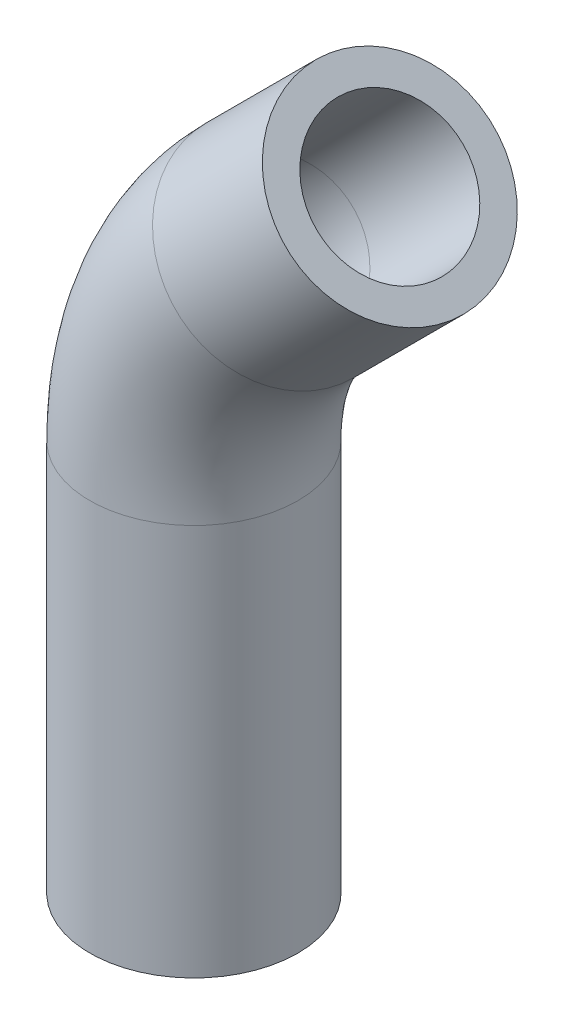
from build123d import *

# Parameters (mm, degrees)
SWEEP1_PROFILE_R     = 13.49375
CUT_SWEEP1_PROFILE_R = 9.525


with BuildPart() as part:
    # Sweep1: sweep along a curve in space
    with BuildLine() as sweep1_path:
        Line((0, 0, 0), (0, 50.8, 0))
        ThreePointArc((0, 50.8, 0), (2.900189811, 65.380238773, 0), (11.159231637, 77.740768363, 0))
        Line((11.159231637, 77.740768363, 0), (25.4, 91.981536726, 0))
    # Sweep1 profile (on start of the path) → Sweep1 (sweep)
    with BuildSketch(Plane.ZX):
        Circle(SWEEP1_PROFILE_R)
    sweep(path=sweep1_path.line)

    # Cut-Sweep1: sweep along a curve in space
    with BuildLine() as cut_sweep1_path:
        Line((0, 0, 0), (0, 50.8, 0))
        ThreePointArc((0, 50.8, 0), (2.900189811, 65.380238773, 0), (11.159231637, 77.740768363, 0))
        Line((11.159231637, 77.740768363, 0), (25.4, 91.981536726, 0))
    # Cut-Sweep1 profile (on start of the path) → Cut-Sweep1 (sweep, cut)
    with BuildSketch(Plane.ZX):
        Circle(CUT_SWEEP1_PROFILE_R)
    sweep(path=cut_sweep1_path.line, mode=Mode.SUBTRACT)


solid = part.part
